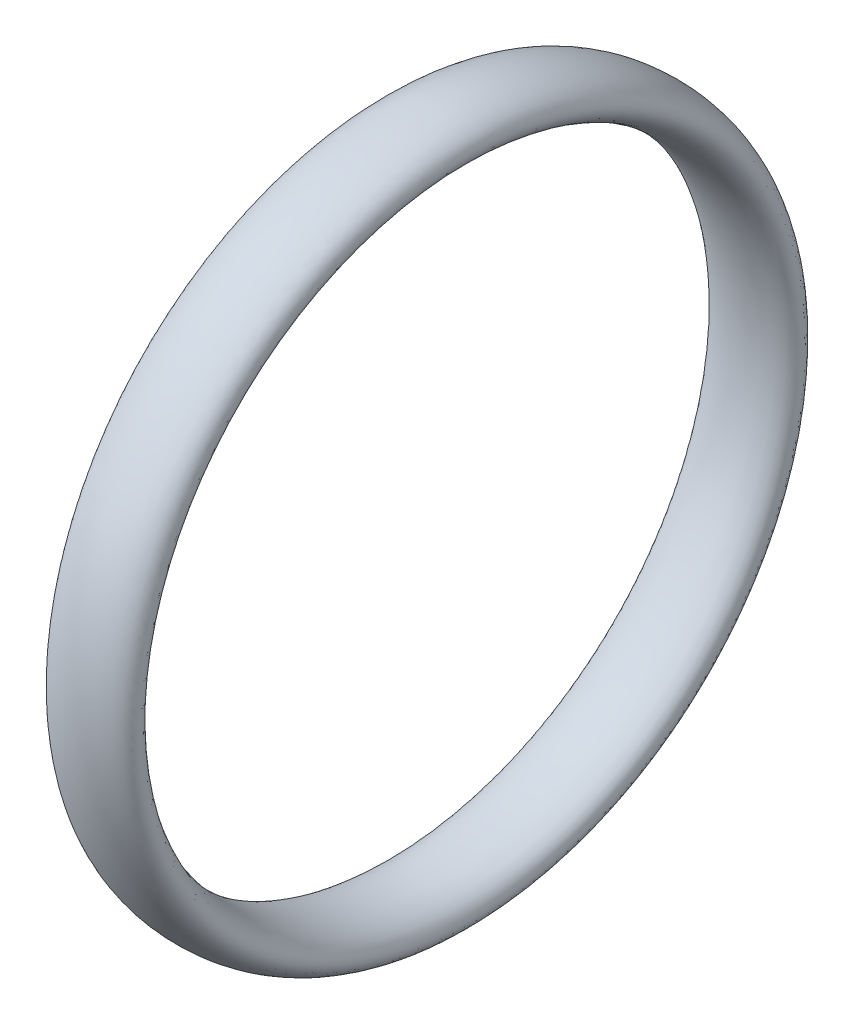
from build123d import *

# Parameters (mm, degrees)
SKETCH1_RX = 1
SKETCH1_RY = 0.5


with BuildPart() as part:
    # Sketch1 → Revolve1 (revolve)
    with BuildSketch(Plane.XY):
        with Locations((0, 7.5)):
            Ellipse(SKETCH1_RX, SKETCH1_RY)
    revolve(axis=Axis((0, 0, 0), (1, 0, 0)))


solid = part.part
